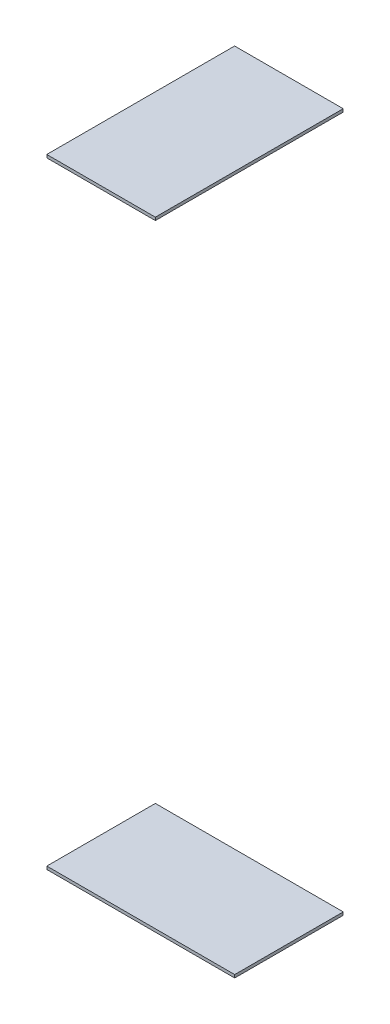
from build123d import *

# Parameters (mm, degrees)
SKETCH2_W           = 100.022593171
SKETCH2_H           = 1.5875
BOSS_EXTRUDE1_DEPTH = 150
SKETCH3_W           = 100.022593171
SKETCH3_H           = 92.221136112
CUT_EXTRUDE1_DEPTH  = 1.5875
SKETCH4_W           = 100
SKETCH4_H           = 1.5875
BOSS_EXTRUDE2_DEPTH = 100
SKETCH5_W           = 42.198542941
SKETCH5_H           = 100
CUT_EXTRUDE2_DEPTH  = 1.5875


with BuildPart() as part:
    # Sketch2 → Boss-Extrude1 (new body)
    with BuildSketch(Plane.XY):
        with Locations((50.011296586, 0.79375)):
            Rectangle(SKETCH2_W, SKETCH2_H)
    extrude(amount=BOSS_EXTRUDE1_DEPTH)

    # Sketch3 → Cut-Extrude1 (cut)
    with BuildSketch(Plane.XZ):
        with Locations((50.011296586, 103.889431944)):
            Rectangle(SKETCH3_W, SKETCH3_H)
    extrude(amount=-CUT_EXTRUDE1_DEPTH, mode=Mode.SUBTRACT)


with BuildPart() as body_2:
    # Sketch4 → Boss-Extrude2 (new body)
    with BuildSketch(Plane.ZY.offset(128.6475)):
        with Locations((-178.6475, 142.432757657)):
            Rectangle(SKETCH4_W, SKETCH4_H)
    extrude(amount=BOSS_EXTRUDE2_DEPTH)

    # Sketch5 → Cut-Extrude2 (cut)
    with BuildSketch(Plane.XZ.offset(-141.639007657)):
        with Locations((-207.54822853, -178.6475)):
            Rectangle(SKETCH5_W, SKETCH5_H)
    extrude(amount=-CUT_EXTRUDE2_DEPTH, mode=Mode.SUBTRACT)


solid = Compound([part.part, body_2.part])
